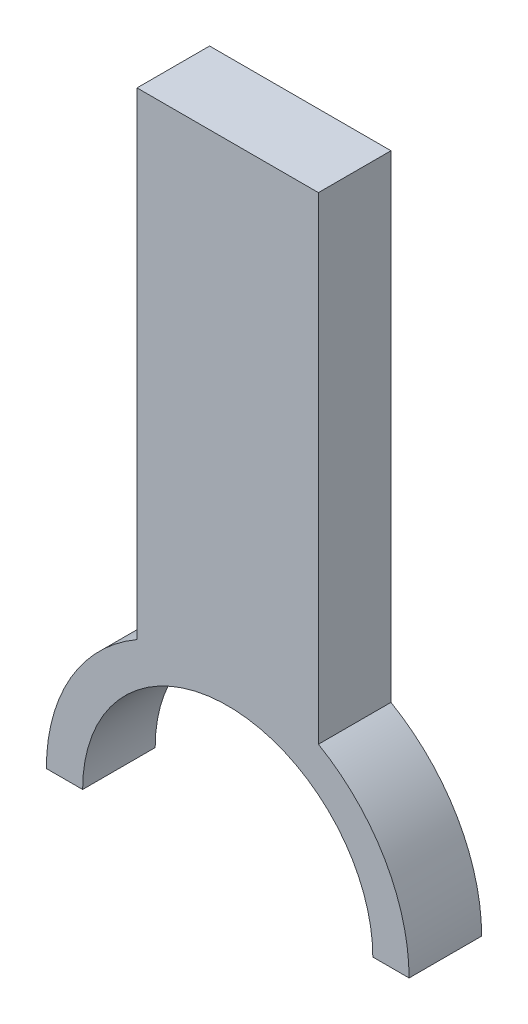
from build123d import *

# Parameters (mm, degrees)
BOSS_EXTRUDE1_DEPTH = 4


with BuildPart() as part:
    # Sketch1 → Boss-Extrude1 (new body)
    with BuildSketch(Plane.XY):
        with BuildLine():
            Line((10, 0), (8, 0))
            ThreePointArc((8, 0), (0, 8), (-8, 0))
            Line((-8, 0), (-10, 0))
            ThreePointArc((-10, 0), (-8.660254038, 5), (-5, 8.660254038))
            Line((-5, 8.660254038), (-5, 35))
            Line((-5, 35), (5, 35))
            Line((5, 35), (5, 8.660254038))
            ThreePointArc((5, 8.660254038), (8.660254038, 5), (10, 0))
        make_face()
    extrude(amount=BOSS_EXTRUDE1_DEPTH)


solid = part.part
